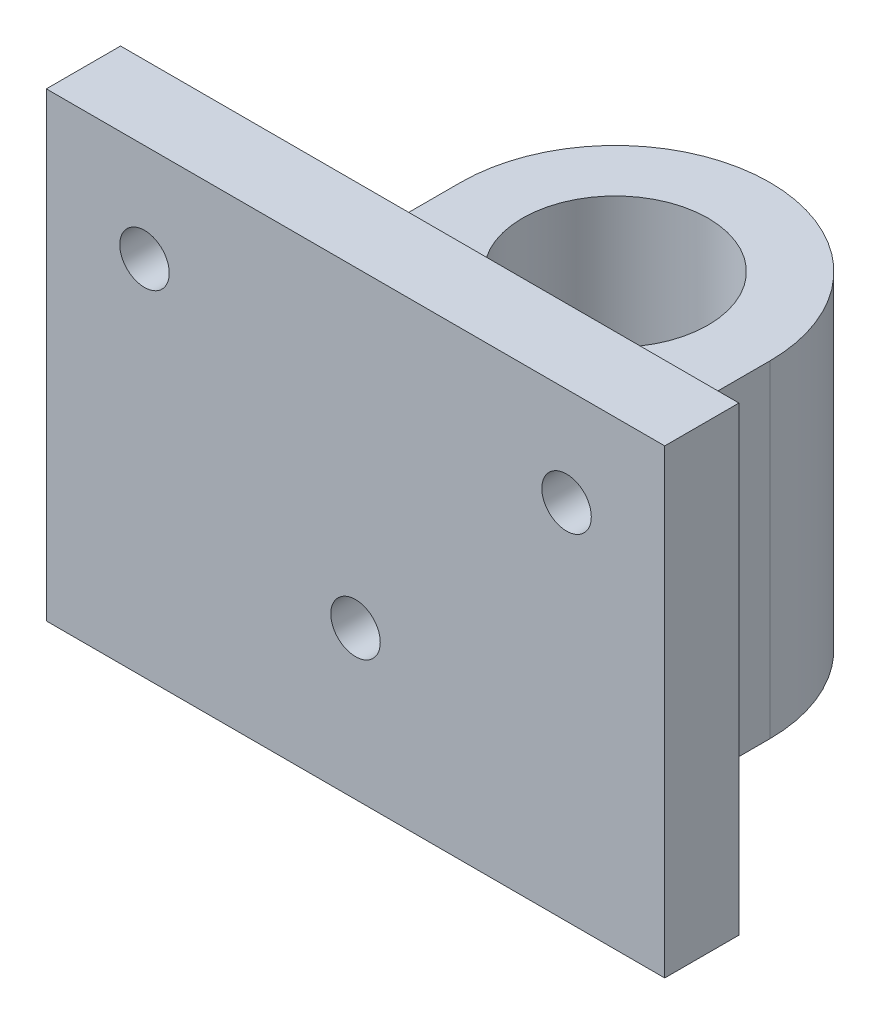
from build123d import *

# Parameters (mm, degrees)
PROFILE_SKETCH1_R                          = 7.5
PROFILE_BOSS_EXTRUDE2_DEPTH                = 37.25987
FASTENINGHOLESKETCH3_R                     = 2
FASTENINGHOLECUT_EXTRUDE8_DEPTH            = 56.995963358
LM8UUFASTENINGHOLESKETCH5_R                = 2
LM8UUFASTENINGHOLECUT_EXTRUDE9_DEPTH       = 56.995963425
TOPKNOTCHSKETCH2_W                         = 50
TOPKNOTCHSKETCH2_H                         = 27.5
TOPKNOTCHCUT_EXTRUDE1_DEPTH                = 10.8
RIGHTZAXISMICROSWITCHCUT_EXTRUDE1_DEPTH    = 12.05
MICROSWITCHMOUNTINGHOLESSKETCH1_R          = 1.5
MICROSWITCHMOUNTINGHOLESCUT_EXTRUDE1_DEPTH = 3.1


with BuildPart() as part:
    # Profile-Sketch1 → Profile-Boss-Extrude2 (new body)
    with BuildSketch(Plane(origin=(0, 0, 0), x_dir=(1, 0, 0), z_dir=(0, 1, 0))):
        with BuildLine():
            Line((-25, -21), (25, -21))
            Line((25, -21), (25, -15))
            Line((25, -15), (22.5, -15))
            ThreePointArc((22.5, -15), (15.428932188, -12.071067812), (12.5, -5))
            Line((12.5, -5), (12.5, 0))
            ThreePointArc((12.5, 0), (0, 12.5), (-12.5, 0))
            Line((-12.5, 0), (-12.5, -5))
            ThreePointArc((-12.5, -5), (-15.428932188, -12.071067812), (-22.5, -15))
            Line((-22.5, -15), (-25, -15))
            Line((-25, -15), (-25, -21))
        make_face()
        with Locations(Location((0, 0, 0), (0, 0, 270))):
            Circle(PROFILE_SKETCH1_R, mode=Mode.SUBTRACT)
    extrude(amount=PROFILE_BOSS_EXTRUDE2_DEPTH)

    # FasteningHoleSketch3 → FasteningHoleCut-Extrude8 (cut, through all)
    with BuildSketch(Plane.XY.offset(21)):
        with Locations((-17.0625, 29.32237)):
            Circle(FASTENINGHOLESKETCH3_R)
        with Locations((17.0625, 29.32237)):
            Circle(FASTENINGHOLESKETCH3_R)
    extrude(amount=-FASTENINGHOLECUT_EXTRUDE8_DEPTH, mode=Mode.SUBTRACT)

    # LM8UUFasteningHoleSketch5 → LM8UUFasteningHoleCut-Extrude9 (cut, through all)
    with BuildSketch(Plane.XY.offset(21)):
        with Locations((0, 12)):
            Circle(LM8UUFASTENINGHOLESKETCH5_R)
    extrude(amount=-LM8UUFASTENINGHOLECUT_EXTRUDE9_DEPTH, mode=Mode.SUBTRACT)

    # TopKnotchSketch2 → TopKnotchCut-Extrude1 (cut)
    with BuildSketch(Plane(origin=(0, 37.25987, 0), x_dir=(1, 0, 0), z_dir=(0, 1, 0))):
        with Locations((0, -1.25)):
            Rectangle(TOPKNOTCHSKETCH2_W, TOPKNOTCHSKETCH2_H)
    extrude(amount=-TOPKNOTCHCUT_EXTRUDE1_DEPTH, mode=Mode.SUBTRACT)

    # RightZAxisMicroSwitchSketch2 → RightZAxisMicroSwitchCut-Extrude1 (cut)
    with BuildSketch(Plane.XZ):
        Polygon((-11.1, 0), (-13.9, 0), (-13.9, 10.086005596), (-16.342618224, 12.85), (-13.9, 12.85), (-11.1, 12.85), align=None)
    extrude(amount=-RIGHTZAXISMICROSWITCHCUT_EXTRUDE1_DEPTH, mode=Mode.SUBTRACT)

    # MicroSwitchMountingHolesSketch1 → MicroSwitchMountingHolesCut-Extrude1 (cut)
    with BuildSketch(Plane.ZY.offset(11.1)):
        with Locations((3.25, 5.05)):
            Circle(MICROSWITCHMOUNTINGHOLESSKETCH1_R)
        with Locations((9.6, 5.05)):
            Circle(MICROSWITCHMOUNTINGHOLESSKETCH1_R)
    extrude(amount=-MICROSWITCHMOUNTINGHOLESCUT_EXTRUDE1_DEPTH, mode=Mode.SUBTRACT)


solid = part.part
